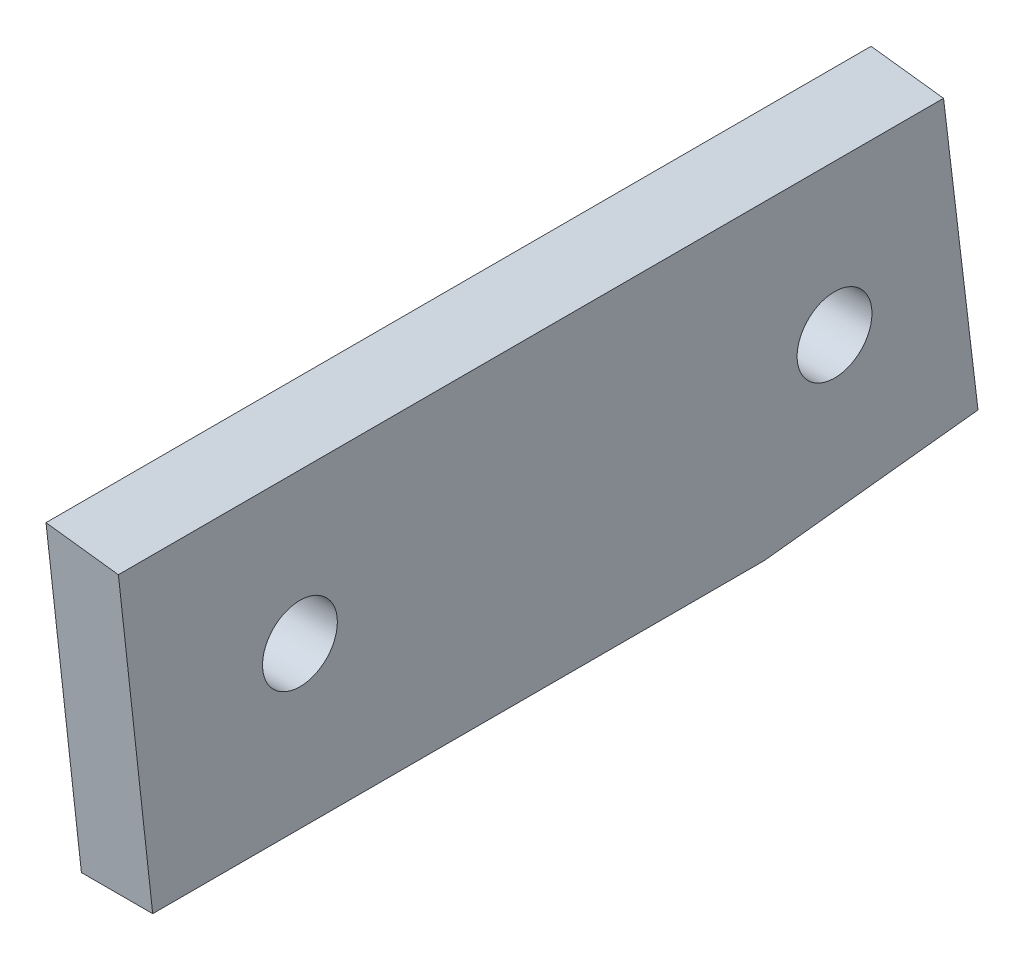
from build123d import *

# Parameters (mm, degrees)
EXTRUSION1_DEPTH  = 48.3
TROU_TARAUD_M51_D = 4.2
EXTRUSION2_DEPTH  = 52.7
EXTRUSION3_DEPTH  = 52.7


with BuildPart() as part:
    # Esquisse1 → Extrusion1 (new body)
    with BuildSketch(Plane.XY):
        Polygon((0, 0), (4, 0), (4, 17.437836661), (0, 18), align=None)
    extrude(amount=EXTRUSION1_DEPTH)

    # Trou taraudé M51 (through all)
    with Locations(Plane(origin=(4, 0, 0), x_dir=(0, 0, -1), z_dir=(1, 0, 0))):
        with Locations((-8.05, 9), (-38.05, 9)):
            Hole(TROU_TARAUD_M51_D / 2)

    # Esquisse4 → Extrusion2 (cut, through all)
    with BuildSketch(Plane.ZY):
        Polygon((48.3, 18), (46.312781499, 0), (48.3, 0), align=None)
        Polygon((0, 0), (0, 1.324812334), (12, 0), align=None)
    extrude(amount=-EXTRUSION2_DEPTH, mode=Mode.SUBTRACT)

    # Esquisse5 → Extrusion3 (cut, through all)
    with BuildSketch(Plane.ZY):
        Polygon((0, 1.324812334), (2, 18), (0, 18), align=None)
    extrude(amount=-EXTRUSION3_DEPTH, mode=Mode.SUBTRACT)


solid = part.part
